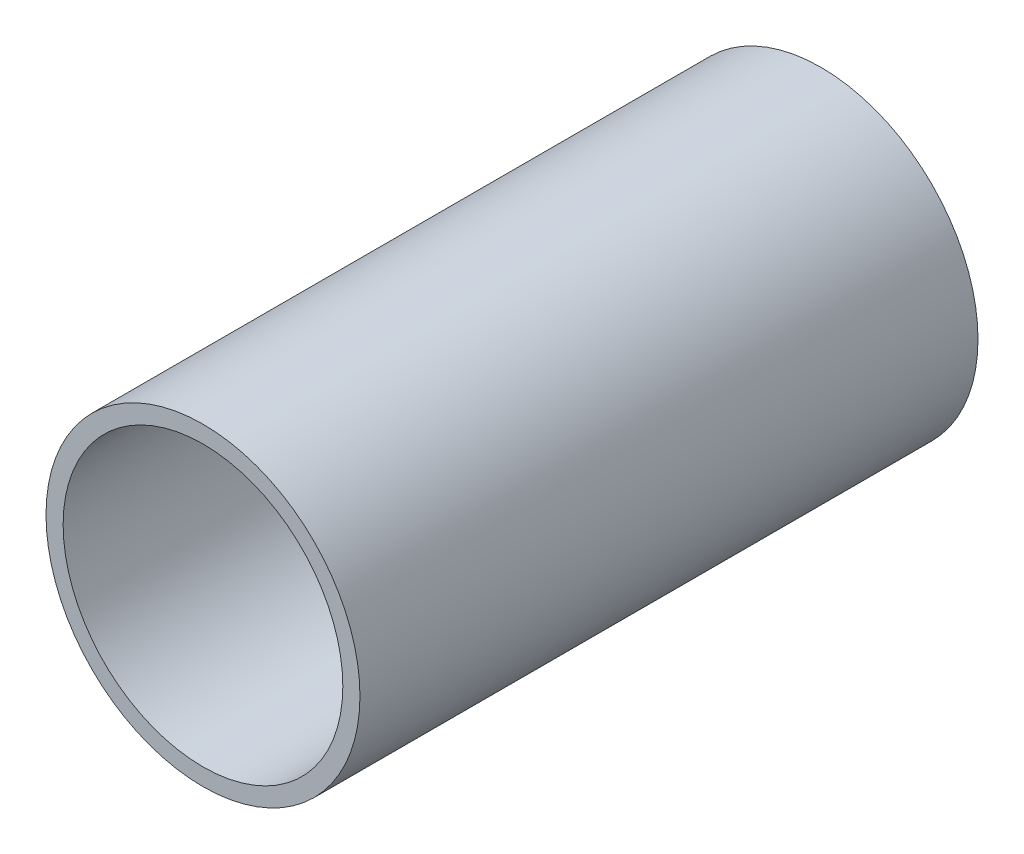
from build123d import *

# Parameters (mm, degrees)
ESBO_O2_W = 150
ESBO_O2_H = 4.16


with BuildPart() as part:
    # Esboço2 → Revolução1 (revolve)
    with BuildSketch(Plane(origin=(0, 0, 0), x_dir=(0, 0, -1), z_dir=(1, 0, 0)), mode=Mode.PRIVATE) as revolu_o1_sk:
        with Locations((75, 36.02)):
            Rectangle(ESBO_O2_W, ESBO_O2_H)
    revolve(revolu_o1_sk.sketch.rotate(Axis((0, 0, 0), (0, 0, -1)), 90), axis=Axis((0, 0, 0), (0, 0, -1)))


solid = part.part
